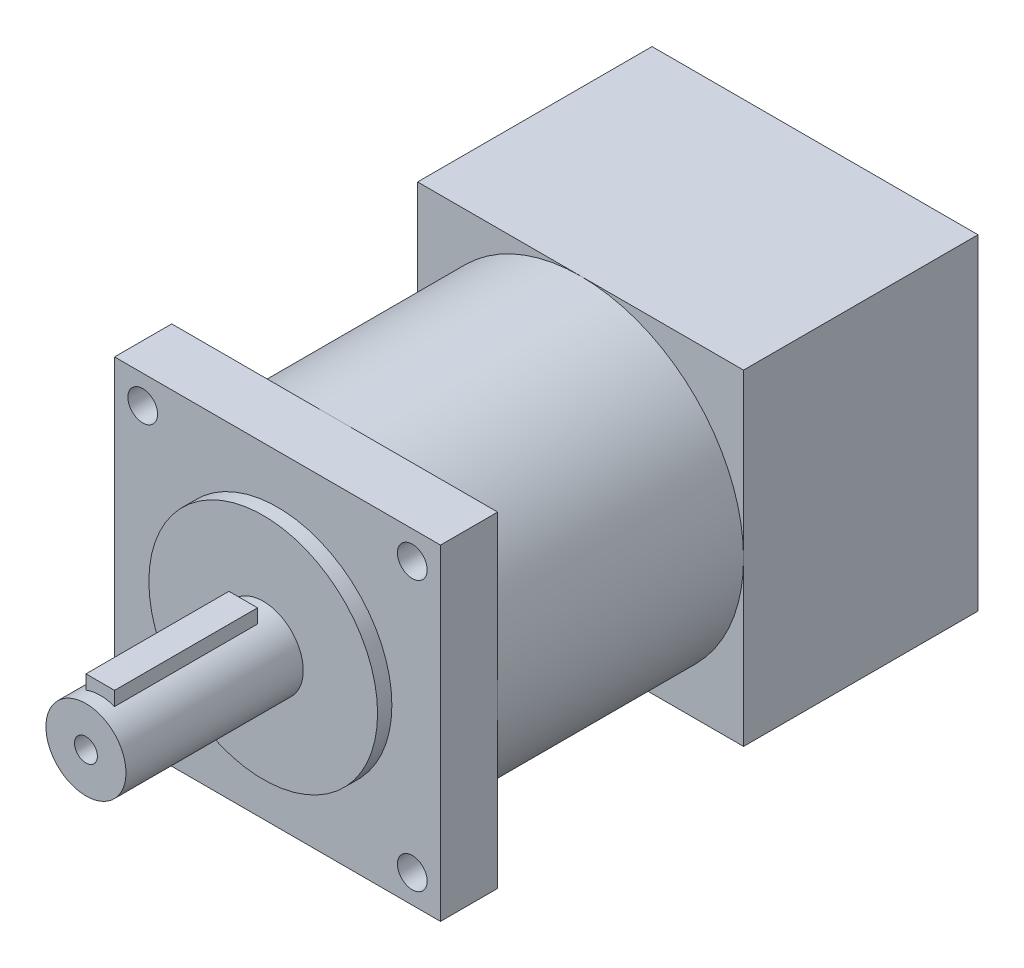
from build123d import *

# Parameters (mm, degrees)
SKETCH_1_W          = 57
SKETCH_1_H          = 57
EXTRUDE_1_DEPTH     = 41
SKETCH_2_R          = 28.5
EXTRUDE_2_DEPTH     = 53
SKETCH_3_R          = 20
EXTRUDE_3_DEPTH     = 2.5
SKETCH_4_R          = 7
EXTRUDE_4_DEPTH     = 31
SKETCH_7_W          = 57
SKETCH_7_H          = 57
SKETCH_7_R          = 2.6
EXTRUDE_5_DEPTH     = 10
SKETCH_8_W          = 5
SKETCH_8_H          = 4
EXTRUDE_6_DEPTH     = 25
SKETCH_9_R          = 2
CUT_EXTRUDE_1_DEPTH = 6


with BuildPart() as part:
    # 草图1 → 凸台-拉伸1 (new body)
    with BuildSketch(Plane.XY):
        Rectangle(SKETCH_1_W, SKETCH_1_H)
    extrude(amount=EXTRUDE_1_DEPTH)

    # 草图2 → 凸台-拉伸2 (add)
    with BuildSketch(Plane.XY.offset(41)):
        Circle(SKETCH_2_R)
    extrude(amount=EXTRUDE_2_DEPTH)

    # 草图3 → 凸台-拉伸3 (add)
    with BuildSketch(Plane.XY.offset(94)):
        Circle(SKETCH_3_R)
    extrude(amount=EXTRUDE_3_DEPTH)

    # 草图4 → 凸台-拉伸4 (add)
    with BuildSketch(Plane.XY.offset(96.5)):
        Circle(SKETCH_4_R)
    extrude(amount=EXTRUDE_4_DEPTH)

    # 草图7 → 凸台-拉伸5 (add)
    with BuildSketch(Plane.XY.offset(94)):
        Rectangle(SKETCH_7_W, SKETCH_7_H)
        with Locations((-23.57, 23.57)):
            Circle(SKETCH_7_R, mode=Mode.SUBTRACT)
        with Locations((23.57, 23.57)):
            Circle(SKETCH_7_R, mode=Mode.SUBTRACT)
        with Locations((23.57, -23.57)):
            Circle(SKETCH_7_R, mode=Mode.SUBTRACT)
        with Locations((-23.57, -23.57)):
            Circle(SKETCH_7_R, mode=Mode.SUBTRACT)
    extrude(amount=-EXTRUDE_5_DEPTH)

    # 草图8 → 凸台-拉伸6 (add)
    with BuildSketch(Plane.XY.offset(125)):
        with Locations((0, 7)):
            Rectangle(SKETCH_8_W, SKETCH_8_H)
    extrude(amount=-EXTRUDE_6_DEPTH)

    # 草图9 → 切除-拉伸1 (cut)
    with BuildSketch(Plane.XY.offset(127.5)):
        Circle(SKETCH_9_R)
    extrude(amount=-CUT_EXTRUDE_1_DEPTH, mode=Mode.SUBTRACT)


solid = part.part
